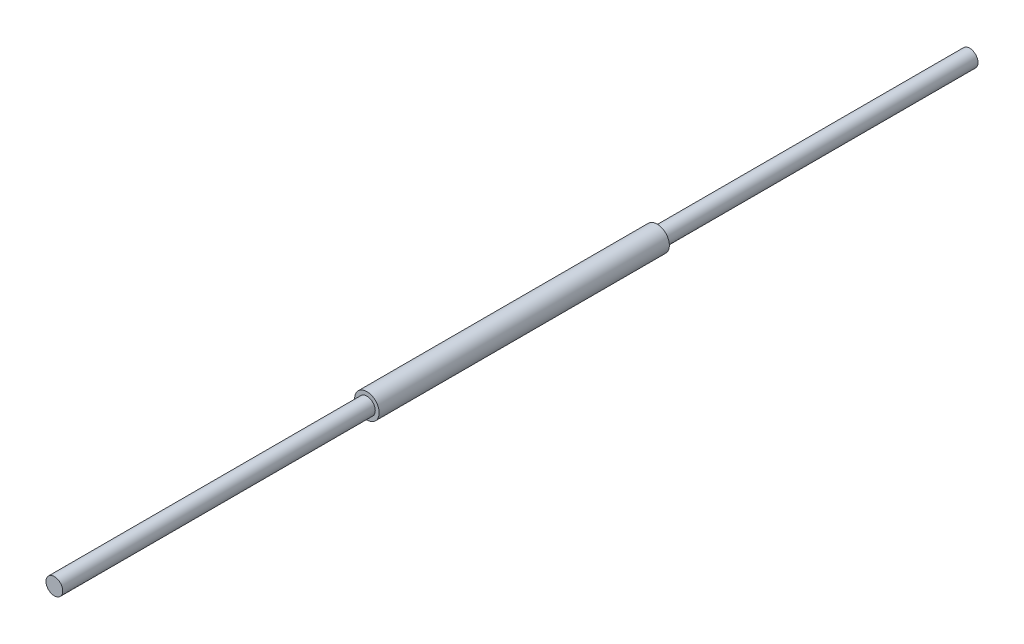
from build123d import *

# Parameters (mm, degrees)
SKETCH1_R           = 4.7625
BOSS_EXTRUDE1_DEPTH = 260.35
SKETCH1_3_R         = 6.985
SKETCH1_3_R_2       = 4.7625
BOSS_EXTRUDE2_DEPTH = 82.55


with BuildPart() as part:
    # Sketch1 → Boss-Extrude1 (new, symmetric)
    with BuildSketch(Plane.XY):
        Circle(SKETCH1_R)
    extrude(amount=BOSS_EXTRUDE1_DEPTH, both=True)

    # Sketch1<3> → Boss-Extrude2 (add, symmetric)
    with BuildSketch(Plane.XY):
        Circle(SKETCH1_3_R)
        Circle(SKETCH1_3_R_2, mode=Mode.SUBTRACT)
    extrude(amount=BOSS_EXTRUDE2_DEPTH, both=True)


solid = part.part
